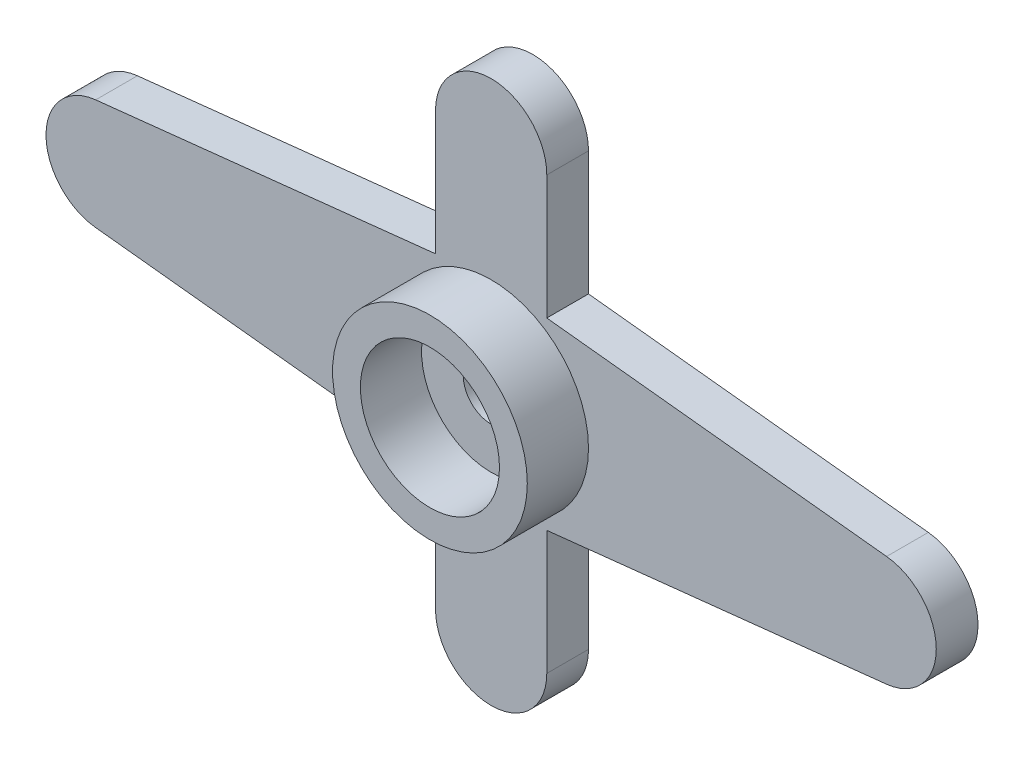
from build123d import *

# Parameters (mm, degrees)
BOSS_EXTRUDE1_DEPTH = 1.5
SKETCH2_R           = 3.5
SKETCH2_R_2         = 2.5
BOSS_EXTRUDE2_DEPTH = 2.2
CUT_EXTRUDE1_REACH  = 20.87
SKETCH3_R           = 1
SKETCH4_R           = 2.5
CUT_EXTRUDE2_DEPTH  = 1


with BuildPart() as part:
    # Sketch1 → Boss-Extrude1 (new body)
    with BuildSketch(Plane.XY):
        with BuildLine():
            Line((2, 7.75863865), (2, 3.304737557))
            Line((2, 3.304737557), (14.214285714, 1.988487272))
            ThreePointArc((14.214285714, 1.988487272), (16, 0), (14.214285714, -1.988487272))
            Line((14.214285714, -1.988487272), (2, -3.304737557))
            Line((2, -3.304737557), (2, -7.75863865))
            ThreePointArc((2, -7.75863865), (0, -9.75863865), (-2, -7.75863865))
            Line((-2, -7.75863865), (-2, -3.304737557))
            Line((-2, -3.304737557), (-14.214285714, -1.988487272))
            ThreePointArc((-14.214285714, -1.988487272), (-16, 0), (-14.214285714, 1.988487272))
            Line((-14.214285714, 1.988487272), (-2, 3.304737557))
            Line((-2, 3.304737557), (-2, 7.75863865))
            ThreePointArc((-2, 7.75863865), (0, 9.75863865), (2, 7.75863865))
        make_face()
    extrude(amount=BOSS_EXTRUDE1_DEPTH)

    # Sketch2 → Boss-Extrude2 (add)
    with BuildSketch(Plane.XY.offset(1.5)):
        Circle(SKETCH2_R)
        Circle(SKETCH2_R_2, mode=Mode.SUBTRACT)
    extrude(amount=BOSS_EXTRUDE2_DEPTH)

    # Sketch3 → Cut-Extrude1 (cut, up to next)
    with BuildSketch(Plane.XY.offset(1.5), mode=Mode.PRIVATE) as cut_extrude1_sk1:
        Circle(SKETCH3_R)
    cut_extrude1_tool1 = extrude(cut_extrude1_sk1.sketch, amount=-CUT_EXTRUDE1_REACH, mode=Mode.PRIVATE) & part.part
    add(cut_extrude1_tool1.solids().sort_by_distance((0, 0, 1.5))[0], mode=Mode.SUBTRACT)

    # Sketch4 → Cut-Extrude2 (cut)
    with BuildSketch(Plane(origin=(0, 0, 0), x_dir=(-1, 0, 0), z_dir=(0, 0, -1))):
        with Locations(Location((0, 0, 0), (0, 0, 180))):
            Circle(SKETCH4_R)
    extrude(amount=-CUT_EXTRUDE2_DEPTH, mode=Mode.SUBTRACT)


solid = part.part
